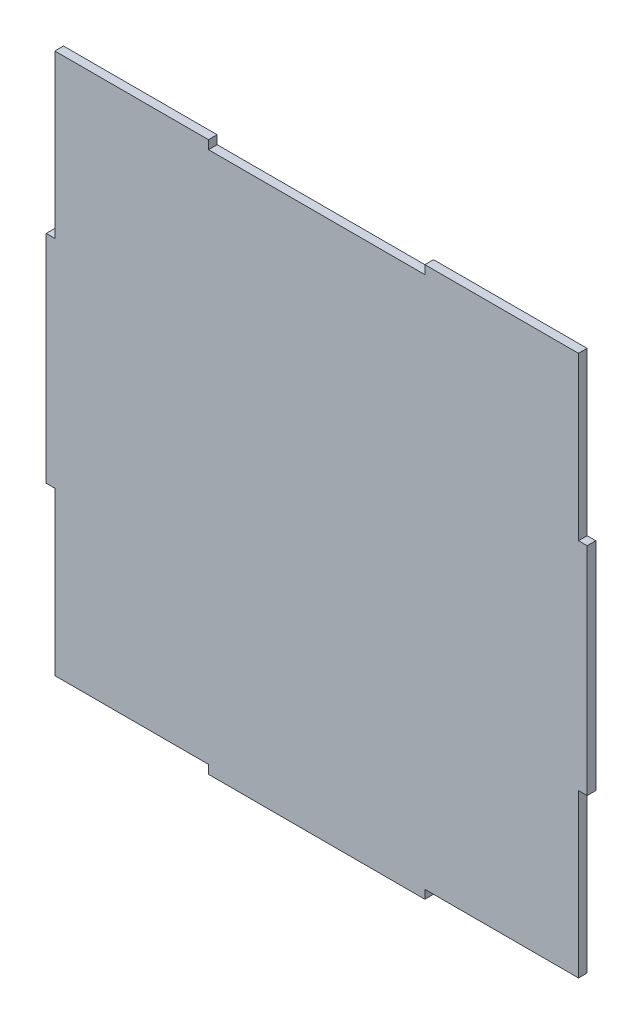
from build123d import *

# Parameters (mm, degrees)
BOSS_EXTRUDE1_DEPTH = 4


with BuildPart() as part:
    # Sketch1 → Boss-Extrude1 (new body)
    with BuildSketch(Plane.XY):
        Polygon((-49.636958624, 1.54619828), (-49.636958624, -2.45380172), (50.363041376, -2.45380172), (50.363041376, 1.54619828), (121.363041376, 1.54619828), (121.363041376, 76.54619828), (125.363041376, 76.54619828), (125.363041376, 176.54619828), (121.363041376, 176.54619828), (121.363041376, 251.54619828), (50.363041376, 251.54619828), (50.363041376, 247.54619828), (-49.636958624, 247.54619828), (-49.636958624, 251.54619828), (-120.636958624, 251.54619828), (-120.636958624, 176.54619828), (-124.636958624, 176.54619828), (-124.636958624, 76.54619828), (-120.636958624, 76.54619828), (-120.636958624, 1.54619828), align=None)
    extrude(amount=BOSS_EXTRUDE1_DEPTH)


solid = part.part
